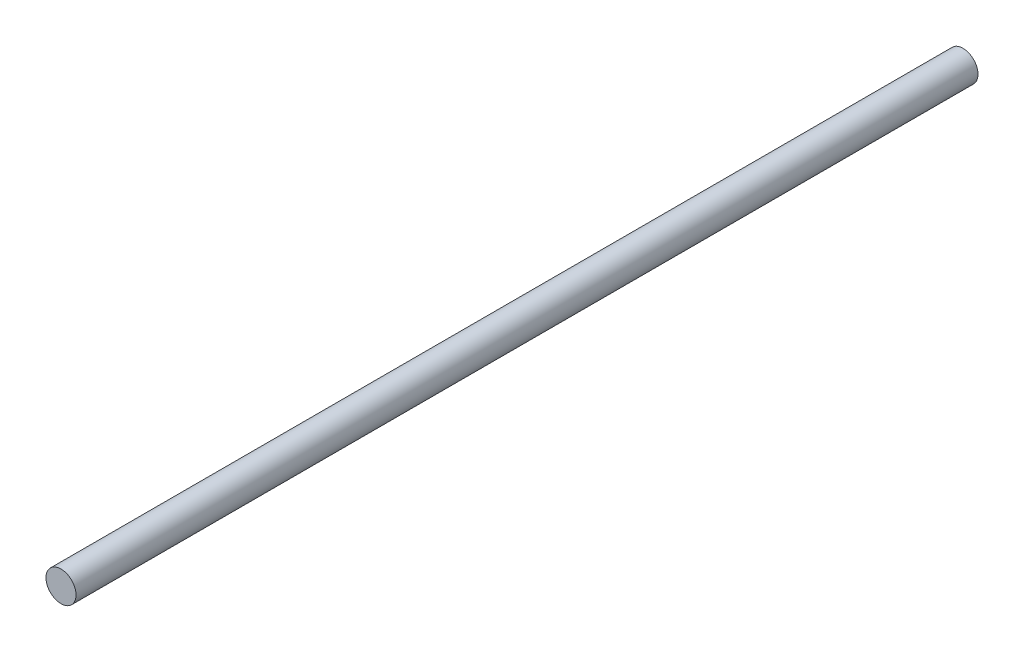
from build123d import *

# Parameters (mm, degrees)
SKETCH2_R           = 25
BOSS_EXTRUDE1_DEPTH = 1500


with BuildPart() as part:
    # Sketch2 → Boss-Extrude1 (new body)
    with BuildSketch(Plane.XY):
        Circle(SKETCH2_R)
    extrude(amount=BOSS_EXTRUDE1_DEPTH)


solid = part.part
